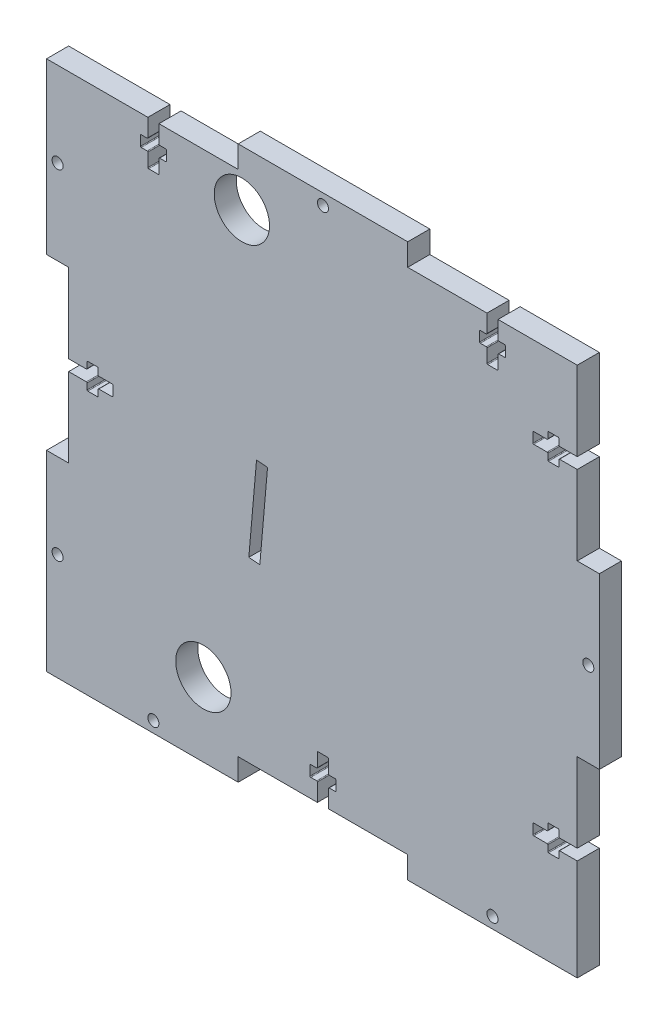
from build123d import *

# Parameters (mm, degrees)
BOX_SIDE_DEPTH       = 6
SKETCH2_R            = 1.5
SCREW_CUT_OUTS_DEPTH = 107.235587258
SKETCH3_R            = 7.5
CUT_EXTRUDE1_DEPTH   = 107.235587258
CUT_EXTRUDE2_DEPTH   = 107.235587258


with BuildPart() as part:
    # Sketch1 → Box Side (new body)
    with BuildSketch(Plane.XY):
        Polygon((-69, 69), (-23, 69), (-23, 75), (23, 75), (23, 69), (69, 69), (69, 23), (75, 23), (75, -23), (69, -23), (69, -69), (69, -75), (23, -75), (23, -69), (-23, -69), (-23, -75), (-69, -75), (-75, -75), (-75, -69), (-75, -23), (-69, -23), (-69, 23), (-75, 23), (-75, 69), align=None)
    extrude(amount=BOX_SIDE_DEPTH)

    # Sketch2 → Screw Cut-outs (cut, through all)
    with BuildSketch(Plane.XY.offset(6)):
        with Locations((0, 72)):
            Circle(SKETCH2_R)
        with Locations(Location((72, 0, 0), (0, 0, 180))):
            Circle(SKETCH2_R)
        with Locations((-46, -72)):
            Circle(SKETCH2_R)
        with Locations(Location((46, -72, 0), (0, 0, 180))):
            Circle(SKETCH2_R)
        with Locations((-72, 46)):
            Circle(SKETCH2_R)
        with Locations(Location((-72, -46, 0), (0, 0, 180))):
            Circle(SKETCH2_R)
        with BuildLine():
            Line((-44.5, 69), (-44.5, 64.2))
            ThreePointArc((-44.5, 64.2), (-44.441421356, 64.058578644), (-44.3, 64))
            Line((-44.3, 64), (-42.7, 64))
            ThreePointArc((-42.7, 64), (-42.558578644, 63.941421356), (-42.5, 63.8))
            Line((-42.5, 63.8), (-42.5, 61.2))
            ThreePointArc((-42.5, 61.2), (-42.558578644, 61.058578644), (-42.7, 61))
            Line((-42.7, 61), (-44.3, 61))
            ThreePointArc((-44.3, 61), (-44.441421356, 60.941421356), (-44.5, 60.8))
            Line((-44.5, 60.8), (-44.5, 57.2))
            ThreePointArc((-44.5, 57.2), (-44.558578644, 57.058578644), (-44.7, 57))
            Line((-44.7, 57), (-47.3, 57))
            ThreePointArc((-47.3, 57), (-47.441421356, 57.058578644), (-47.5, 57.2))
            Line((-47.5, 57.2), (-47.5, 60.8))
            ThreePointArc((-47.5, 60.8), (-47.558578644, 60.941421356), (-47.7, 61))
            Line((-47.7, 61), (-49.3, 61))
            ThreePointArc((-49.3, 61), (-49.441421356, 61.058578644), (-49.5, 61.2))
            Line((-49.5, 61.2), (-49.5, 63.8))
            ThreePointArc((-49.5, 63.8), (-49.441421356, 63.941421356), (-49.3, 64))
            Line((-49.3, 64), (-47.7, 64))
            ThreePointArc((-47.7, 64), (-47.558578644, 64.058578644), (-47.5, 64.2))
            Line((-47.5, 64.2), (-47.5, 69))
            Line((-47.5, 69), (-44.5, 69))
        make_face()
        with BuildLine():
            Line((47.5, 69), (47.5, 64.2))
            ThreePointArc((47.5, 64.2), (47.558578644, 64.058578644), (47.7, 64))
            Line((47.7, 64), (49.3, 64))
            ThreePointArc((49.3, 64), (49.441421356, 63.941421356), (49.5, 63.8))
            Line((49.5, 63.8), (49.5, 61.2))
            ThreePointArc((49.5, 61.2), (49.441421356, 61.058578644), (49.3, 61))
            Line((49.3, 61), (47.7, 61))
            ThreePointArc((47.7, 61), (47.558578644, 60.941421356), (47.5, 60.8))
            Line((47.5, 60.8), (47.5, 57.2))
            ThreePointArc((47.5, 57.2), (47.441421356, 57.058578644), (47.3, 57))
            Line((47.3, 57), (44.7, 57))
            ThreePointArc((44.7, 57), (44.558578644, 57.058578644), (44.5, 57.2))
            Line((44.5, 57.2), (44.5, 60.8))
            ThreePointArc((44.5, 60.8), (44.441421356, 60.941421356), (44.3, 61))
            Line((44.3, 61), (42.7, 61))
            ThreePointArc((42.7, 61), (42.558578644, 61.058578644), (42.5, 61.2))
            Line((42.5, 61.2), (42.5, 63.8))
            ThreePointArc((42.5, 63.8), (42.558578644, 63.941421356), (42.7, 64))
            Line((42.7, 64), (44.3, 64))
            ThreePointArc((44.3, 64), (44.441421356, 64.058578644), (44.5, 64.2))
            Line((44.5, 64.2), (44.5, 69))
            Line((44.5, 69), (47.5, 69))
        make_face()
        with BuildLine():
            Line((69, 44.5), (64.2, 44.5))
            ThreePointArc((64.2, 44.5), (64.058578644, 44.441421356), (64, 44.3))
            Line((64, 44.3), (64, 42.7))
            ThreePointArc((64, 42.7), (63.941421356, 42.558578644), (63.8, 42.5))
            Line((63.8, 42.5), (61.2, 42.5))
            ThreePointArc((61.2, 42.5), (61.058578644, 42.558578644), (61, 42.7))
            Line((61, 42.7), (61, 44.3))
            ThreePointArc((61, 44.3), (60.941421356, 44.441421356), (60.8, 44.5))
            Line((60.8, 44.5), (57.2, 44.5))
            ThreePointArc((57.2, 44.5), (57.058578644, 44.558578644), (57, 44.7))
            Line((57, 44.7), (57, 47.3))
            ThreePointArc((57, 47.3), (57.058578644, 47.441421356), (57.2, 47.5))
            Line((57.2, 47.5), (60.8, 47.5))
            ThreePointArc((60.8, 47.5), (60.941421356, 47.558578644), (61, 47.7))
            Line((61, 47.7), (61, 49.3))
            ThreePointArc((61, 49.3), (61.058578644, 49.441421356), (61.2, 49.5))
            Line((61.2, 49.5), (63.8, 49.5))
            ThreePointArc((63.8, 49.5), (63.941421356, 49.441421356), (64, 49.3))
            Line((64, 49.3), (64, 47.7))
            ThreePointArc((64, 47.7), (64.058578644, 47.558578644), (64.2, 47.5))
            Line((64.2, 47.5), (69, 47.5))
            Line((69, 47.5), (69, 44.5))
        make_face()
        with BuildLine():
            Line((69, -47.5), (64.2, -47.5))
            ThreePointArc((64.2, -47.5), (64.058578644, -47.558578644), (64, -47.7))
            Line((64, -47.7), (64, -49.3))
            ThreePointArc((64, -49.3), (63.941421356, -49.441421356), (63.8, -49.5))
            Line((63.8, -49.5), (61.2, -49.5))
            ThreePointArc((61.2, -49.5), (61.058578644, -49.441421356), (61, -49.3))
            Line((61, -49.3), (61, -47.7))
            ThreePointArc((61, -47.7), (60.941421356, -47.558578644), (60.8, -47.5))
            Line((60.8, -47.5), (57.2, -47.5))
            ThreePointArc((57.2, -47.5), (57.058578644, -47.441421356), (57, -47.3))
            Line((57, -47.3), (57, -44.7))
            ThreePointArc((57, -44.7), (57.058578644, -44.558578644), (57.2, -44.5))
            Line((57.2, -44.5), (60.8, -44.5))
            ThreePointArc((60.8, -44.5), (60.941421356, -44.441421356), (61, -44.3))
            Line((61, -44.3), (61, -42.7))
            ThreePointArc((61, -42.7), (61.058578644, -42.558578644), (61.2, -42.5))
            Line((61.2, -42.5), (63.8, -42.5))
            ThreePointArc((63.8, -42.5), (63.941421356, -42.558578644), (64, -42.7))
            Line((64, -42.7), (64, -44.3))
            ThreePointArc((64, -44.3), (64.058578644, -44.441421356), (64.2, -44.5))
            Line((64.2, -44.5), (69, -44.5))
            Line((69, -44.5), (69, -47.5))
        make_face()
        with BuildLine():
            Line((-1.5, -69), (1.5, -69))
            Line((1.5, -69), (1.5, -64.2))
            ThreePointArc((1.5, -64.2), (1.558578644, -64.058578644), (1.7, -64))
            Line((1.7, -64), (3.3, -64))
            ThreePointArc((3.3, -64), (3.441421356, -63.941421356), (3.5, -63.8))
            Line((3.5, -63.8), (3.5, -61.2))
            ThreePointArc((3.5, -61.2), (3.441421356, -61.058578644), (3.3, -61))
            Line((3.3, -61), (1.7, -61))
            ThreePointArc((1.7, -61), (1.558578644, -60.941421356), (1.5, -60.8))
            Line((1.5, -60.8), (1.5, -57.2))
            ThreePointArc((1.5, -57.2), (1.441421356, -57.058578644), (1.3, -57))
            Line((1.3, -57), (-1.3, -57))
            ThreePointArc((-1.3, -57), (-1.441421356, -57.058578644), (-1.5, -57.2))
            Line((-1.5, -57.2), (-1.5, -60.8))
            ThreePointArc((-1.5, -60.8), (-1.558578644, -60.941421356), (-1.7, -61))
            Line((-1.7, -61), (-3.3, -61))
            ThreePointArc((-3.3, -61), (-3.441421356, -61.058578644), (-3.5, -61.2))
            Line((-3.5, -61.2), (-3.5, -63.8))
            ThreePointArc((-3.5, -63.8), (-3.441421356, -63.941421356), (-3.3, -64))
            Line((-3.3, -64), (-1.7, -64))
            ThreePointArc((-1.7, -64), (-1.558578644, -64.058578644), (-1.5, -64.2))
            Line((-1.5, -64.2), (-1.5, -69))
        make_face()
        with BuildLine():
            Line((-69, -1.5), (-64.2, -1.5))
            ThreePointArc((-64.2, -1.5), (-64.058578644, -1.558578644), (-64, -1.7))
            Line((-64, -1.7), (-64, -3.3))
            ThreePointArc((-64, -3.3), (-63.941421356, -3.441421356), (-63.8, -3.5))
            Line((-63.8, -3.5), (-61.2, -3.5))
            ThreePointArc((-61.2, -3.5), (-61.058578644, -3.441421356), (-61, -3.3))
            Line((-61, -3.3), (-61, -1.7))
            ThreePointArc((-61, -1.7), (-60.941421356, -1.558578644), (-60.8, -1.5))
            Line((-60.8, -1.5), (-57.2, -1.5))
            ThreePointArc((-57.2, -1.5), (-57.058578644, -1.441421356), (-57, -1.3))
            Line((-57, -1.3), (-57, 1.3))
            ThreePointArc((-57, 1.3), (-57.058578644, 1.441421356), (-57.2, 1.5))
            Line((-57.2, 1.5), (-60.8, 1.5))
            ThreePointArc((-60.8, 1.5), (-60.941421356, 1.558578644), (-61, 1.7))
            Line((-61, 1.7), (-61, 3.3))
            ThreePointArc((-61, 3.3), (-61.058578644, 3.441421356), (-61.2, 3.5))
            Line((-61.2, 3.5), (-63.8, 3.5))
            ThreePointArc((-63.8, 3.5), (-63.941421356, 3.441421356), (-64, 3.3))
            Line((-64, 3.3), (-64, 1.7))
            ThreePointArc((-64, 1.7), (-64.058578644, 1.558578644), (-64.2, 1.5))
            Line((-64.2, 1.5), (-69, 1.5))
            Line((-69, 1.5), (-69, -1.5))
        make_face()
    extrude(amount=-SCREW_CUT_OUTS_DEPTH, mode=Mode.SUBTRACT)

    # Sketch3 → Cut-Extrude1 (cut, through all)
    with BuildSketch(Plane.XY.offset(6)):
        with Locations((-22, 60)):
            Circle(SKETCH3_R)
        with Locations((-32.45, -55)):
            Circle(SKETCH3_R)
    extrude(amount=-CUT_EXTRUDE1_DEPTH, mode=Mode.SUBTRACT)

    # Sketch4 → Cut-Extrude2 (cut, through all)
    with BuildSketch(Plane.XY.offset(6)):
        Polygon((-20.112598806, -20.696132422), (-17.124014711, -20.95759965), (-15.032276885, 2.951073104), (-18.02086098, 3.212540333), align=None)
    extrude(amount=-CUT_EXTRUDE2_DEPTH, mode=Mode.SUBTRACT)


solid = part.part
